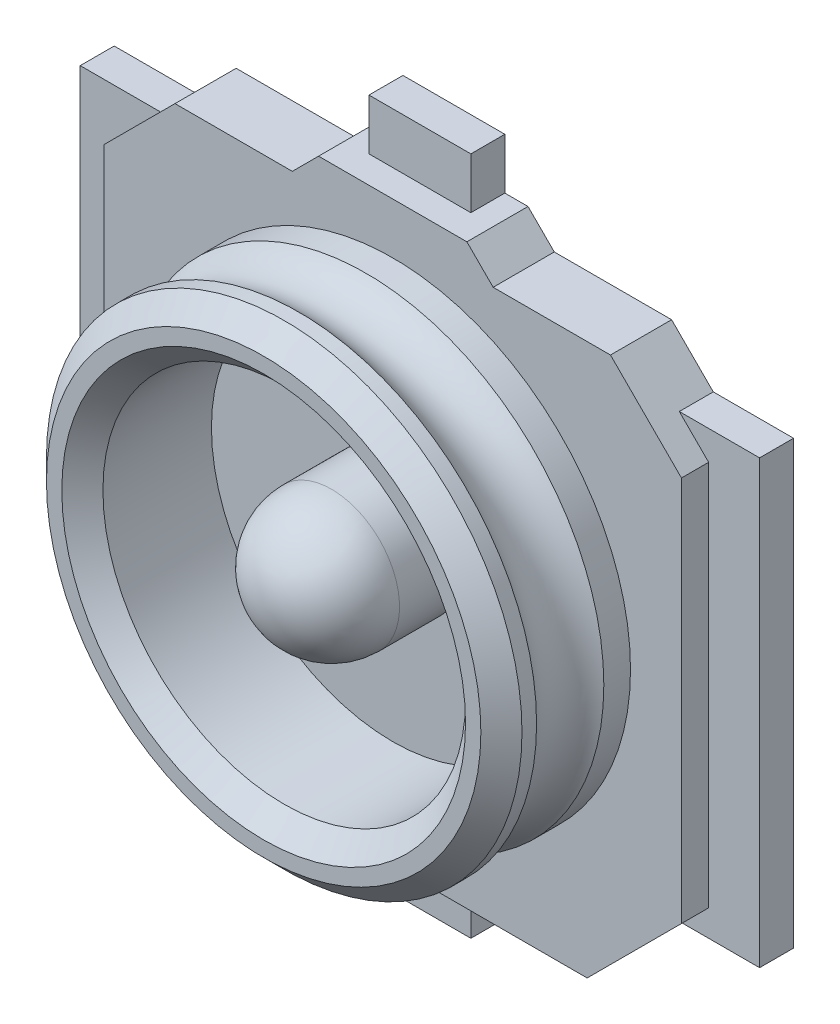
from build123d import *

# Parameters (mm, degrees)
BOSS_EXTRUDE1_DEPTH   = 0.1
SKETCH1_W             = 0.15
SKETCH1_H             = 0.3
BOSS_EXTRUDE1_2_DEPTH = 0.1
SKETCH1_W_2           = 0.3
SKETCH1_H_2           = 1.3
BOSS_EXTRUDE1_3_DEPTH = 0.1
BOSS_EXTRUDE2_DEPTH   = 0.18
SKETCH3_W             = 0.2
SKETCH3_H             = 0.38
FILLET1_R             = 0.2


with BuildPart() as part:
    # Sketch1 → Boss-Extrude1 (new body)
    with BuildSketch(Plane.XY):
        with BuildLine():
            Line((0, 1), (-0.15, 1))
            Line((-0.15, 1), (-0.15, 0.46269883))
            Line((-0.15, 0.46269883), (-0.075, 0.46269883))
            Line((-0.075, 0.46269883), (-0.075, 0.195574953))
            ThreePointArc((-0.075, 0.195574953), (-0.205961394, -0.038137467), (0, -0.209462556))
            Line((0, -0.209462556), (0, 1))
        make_face()
    boss_extrude1 = extrude(amount=BOSS_EXTRUDE1_DEPTH)



with BuildPart() as body_2:
    # Sketch1 → Boss-Extrude1 2 (new body)
    with BuildSketch(Plane.XY):
        with Locations((-0.075, -0.85)):
            Rectangle(SKETCH1_W, SKETCH1_H)
    boss_extrude1_2 = extrude(amount=BOSS_EXTRUDE1_2_DEPTH)


with BuildPart() as body_3:
    # Sketch1 → Boss-Extrude1 3 (new body)
    with BuildSketch(Plane.XY):
        with Locations((-0.85, 0)):
            Rectangle(SKETCH1_W_2, SKETCH1_H_2)
    boss_extrude1_3 = extrude(amount=BOSS_EXTRUDE1_3_DEPTH)


with BuildPart() as part_1:
    add(part.part)

    add(body_2.part)  # Boss-Extrude2 merges body 2

    add(body_3.part)  # Boss-Extrude2 merges body 3
    # Sketch2 → Boss-Extrude2 (add)
    with BuildSketch(Plane.XY):
        Polygon((0, -0.85), (0, 0.85), (-0.218303033, 0.85), (-0.295625525, 0.772677507), (-0.641012319, 0.772677507), (-0.85, 0.563689826), (-0.85, -0.572384616), (-0.572384616, -0.85), align=None)
    boss_extrude2 = extrude(amount=BOSS_EXTRUDE2_DEPTH)

    # Mirror2: Boss-Extrude1, Boss-Extrude1 2, Boss-Extrude1 3, Boss-Extrude2 across plane
    add(boss_extrude1.mirror(Plane(origin=(0, 0, 0), x_dir=(0, 0, 1), z_dir=(1, 0, 0))))
    add(boss_extrude1_2.mirror(Plane(origin=(0, 0, 0), x_dir=(0, 0, 1), z_dir=(1, 0, 0))))
    add(boss_extrude1_3.mirror(Plane(origin=(0, 0, 0), x_dir=(0, 0, 1), z_dir=(1, 0, 0))))
    add(boss_extrude2.mirror(Plane(origin=(0, 0, 0), x_dir=(0, 0, 1), z_dir=(1, 0, 0))))

    # Sketch3 → Revolve1 (revolve)
    with BuildSketch(Plane(origin=(0, 0, 0), x_dir=(1, 0, 0), z_dir=(0, 1, 0)), mode=Mode.PRIVATE) as revolve1_sk:
        with Locations((0.1, -0.37)):
            Rectangle(SKETCH3_W, SKETCH3_H)
        with BuildLine():
            Line((0.533732411, -0.18), (0.533732411, -0.49946823))
            Line((0.533732411, -0.49946823), (0.594264181, -0.56))
            Line((0.594264181, -0.56), (0.63946823, -0.56))
            Line((0.63946823, -0.56), (0.7, -0.49946823))
            Line((0.7, -0.49946823), (0.7, -0.456485922))
            ThreePointArc((0.7, -0.456485922), (0.652125774, -0.357515968), (0.7, -0.258546013))
            Line((0.7, -0.258546013), (0.7, -0.18))
            Line((0.7, -0.18), (0.533732411, -0.18))
        make_face()
    revolve(revolve1_sk.sketch.rotate(Axis((0, 0, 0.18), (0, 0, 1)), 180), axis=Axis((0, 0, 0.18), (0, 0, 1)))

    # Fillet1
    fillet1_edges = [part_1.edges().sort_by_distance(p)[0] for p in [
        (0.2, 0, 0.56),
    ]]
    fillet(fillet1_edges, radius=FILLET1_R)


solid = part_1.part
